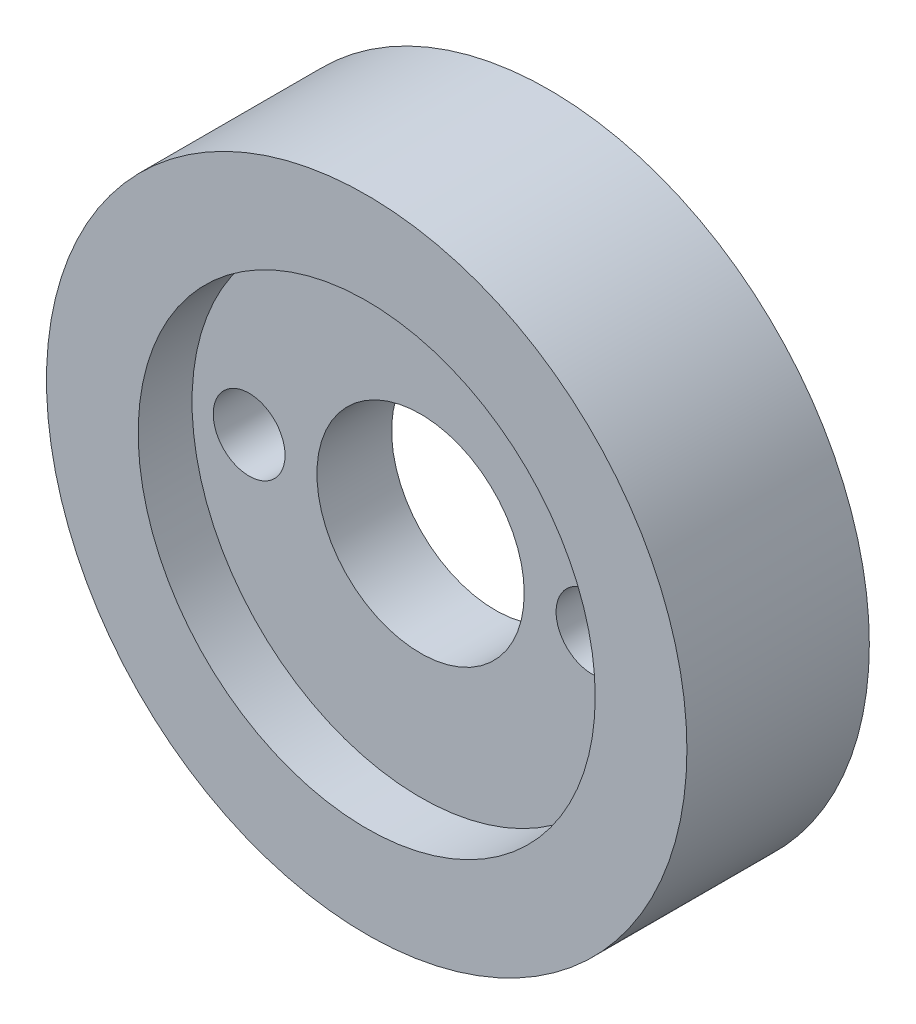
from build123d import *

# Parameters (mm, degrees)
SKETCH1_R           = 9.80909091
SKETCH1_R_2         = 3.175
BOSS_EXTRUDE1_DEPTH = 2.794
CUT_EXTRUDE1_START  = -1.65
SKETCH2_R           = 1.1
CUT_EXTRUDE1_DEPTH  = 1.65
SKETCH2_3_R         = 1.1
CUT_EXTRUDE2_DEPTH  = 15.955342623


with BuildPart() as part:
    # Sketch1 → Boss-Extrude1 (new, symmetric)
    with BuildSketch(Plane.XY):
        Circle(SKETCH1_R)
        Circle(SKETCH1_R_2, mode=Mode.SUBTRACT)
    extrude(amount=BOSS_EXTRUDE1_DEPTH, both=True)

    # Sketch2 → Cut-Extrude1 (cut)
    with BuildSketch(Plane.XY.offset(2.794).offset(CUT_EXTRUDE1_START)):
        with BuildLine():
            ThreePointArc((7, 0), (0, 7), (-7, 0))
            ThreePointArc((-7, 0), (0, -7), (7, 0))
        make_face()
        with BuildLine():
            ThreePointArc((-4.15145, 0), (-5.25145, -1.1), (-6.35145, 0))
            ThreePointArc((-6.35145, 0), (-5.25145, 1.1), (-4.15145, 0))
        make_face(mode=Mode.SUBTRACT)
        with BuildLine():
            ThreePointArc((3.175, 0), (0, -3.175), (-3.175, 0))
            ThreePointArc((-3.175, 0), (0, 3.175), (3.175, 0))
        make_face(mode=Mode.SUBTRACT)
        with Locations((5.25145, 0)):
            Circle(SKETCH2_R, mode=Mode.SUBTRACT)
    cut_extrude1 = extrude(amount=CUT_EXTRUDE1_DEPTH, mode=Mode.SUBTRACT)

    # Mirror1: Cut-Extrude1 across plane
    add(cut_extrude1.mirror(Plane.XY), mode=Mode.SUBTRACT)

    # Sketch2<3> → Cut-Extrude2 (cut, through all)
    with BuildSketch(Plane.XY.offset(2.794)):
        with Locations((-5.25145, 0)):
            Circle(SKETCH2_3_R)
        with Locations((5.25145, 0)):
            Circle(SKETCH2_3_R)
    extrude(amount=-CUT_EXTRUDE2_DEPTH, mode=Mode.SUBTRACT)


solid = part.part
